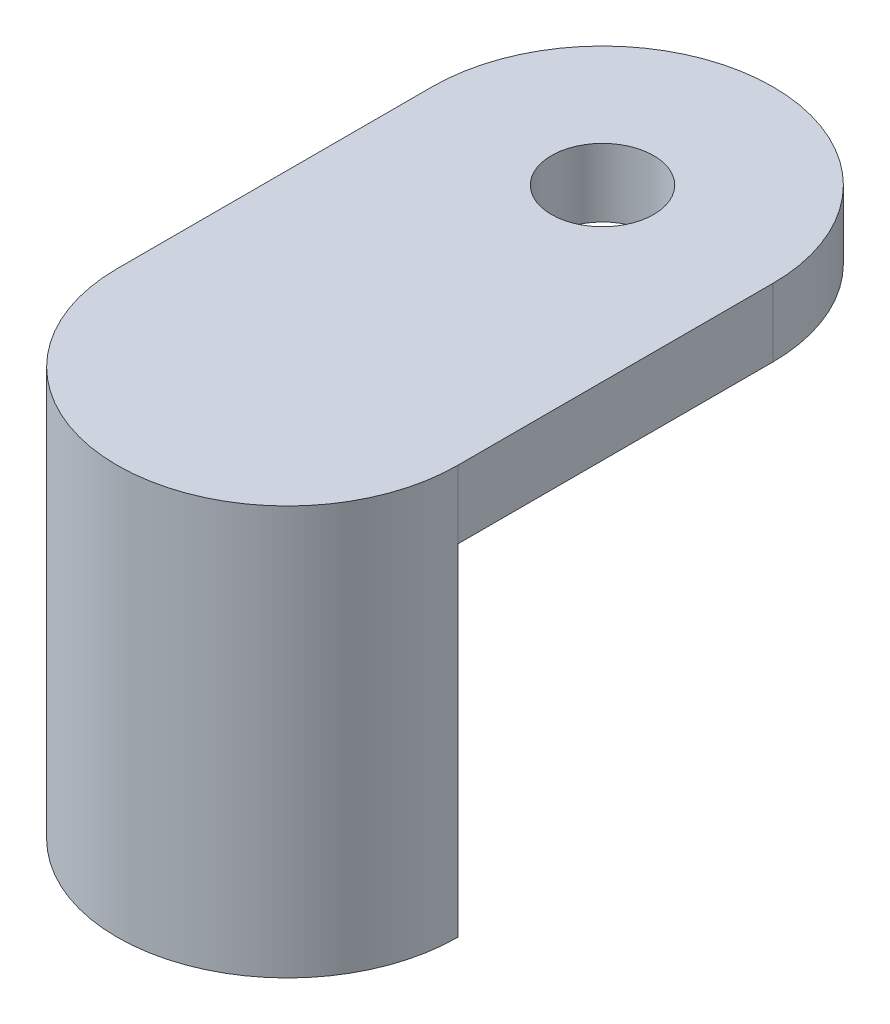
from build123d import *

# Parameters (mm, degrees)
EXTRUDE_1_DEPTH     = 2
SKETCH_2_R          = 1.5
CUT_EXTRUDE_1_DEPTH = 2
EXTRUDE_START       = -12
EXTRUDE_2_DEPTH     = 12


with BuildPart() as part:
    # 草图1 → 凸台-拉伸1 (new body)
    with BuildSketch(Plane(origin=(0, 0, 0), x_dir=(1, 0, 0), z_dir=(0, 1, 0))):
        with BuildLine():
            Line((-5, 0), (-5, -9.25))
            ThreePointArc((-5, -9.25), (0, -14.25), (5, -9.25))
            Line((5, -9.25), (5, 0))
            ThreePointArc((5, 0), (0, 5), (-5, 0))
        make_face()
    extrude(amount=EXTRUDE_1_DEPTH)

    # 草图2 → 切除-拉伸1 (cut)
    with BuildSketch(Plane(origin=(0, 2, 0), x_dir=(1, 0, 0), z_dir=(0, 1, 0))):
        with Locations(Location((0, 0, 0), (0, 0, 270))):
            Circle(SKETCH_2_R)
    extrude(amount=-CUT_EXTRUDE_1_DEPTH, mode=Mode.SUBTRACT)

    # 草图3 → 凸台-拉伸2 (add)
    with BuildSketch(Plane(origin=(0, 2, 0), x_dir=(1, 0, 0), z_dir=(0, 1, 0)).offset(EXTRUDE_START)):
        with BuildLine():
            Line((-5, -9.25), (5, -9.25))
            ThreePointArc((5, -9.25), (0, -14.25), (-5, -9.25))
        make_face()
    extrude(amount=EXTRUDE_2_DEPTH)


solid = part.part
